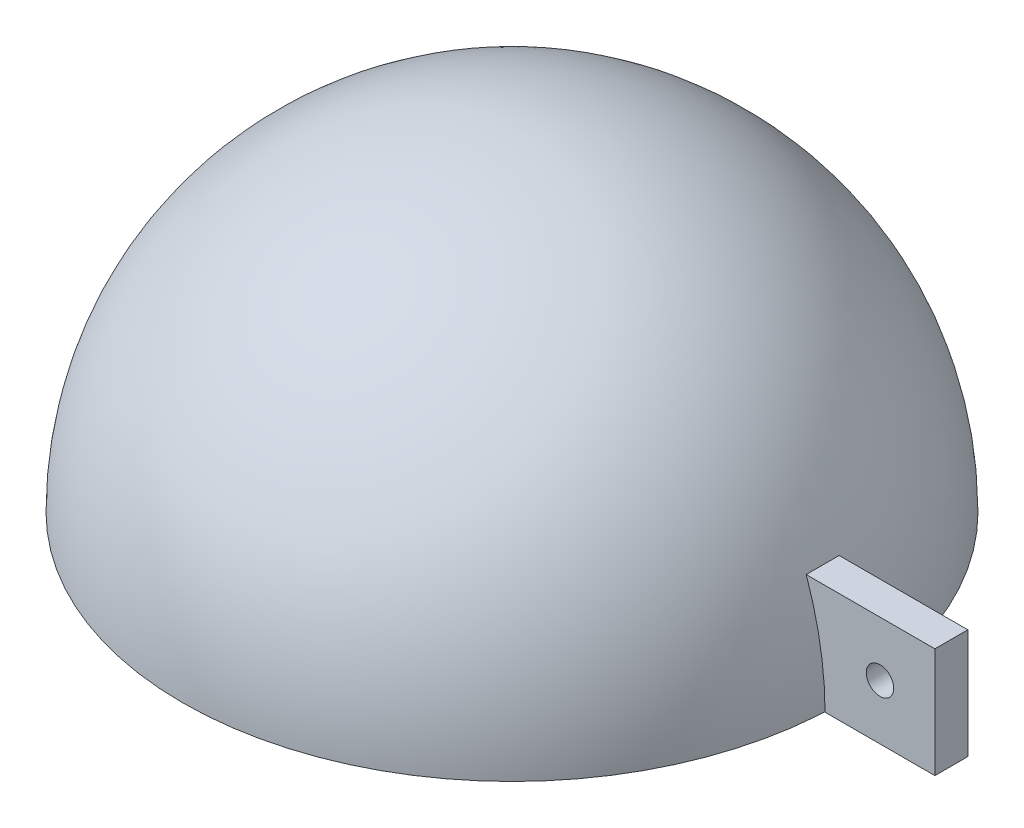
from build123d import *

# Parameters (mm, degrees)
SHELL2_T            = -3
BOSS_EXTRUDE1_DEPTH = 1.5
SKETCH5_W           = 1.25
SKETCH5_H           = 31.5


with BuildPart() as part:
    # Sketch2 → Revolve1 (revolve)
    with BuildSketch(Plane.XY):
        with BuildLine():
            Line((0, 0), (0, 30))
            ThreePointArc((0, 30), (21.213203436, 21.213203436), (30, 0))
            Line((30, 0), (0, 0))
        make_face()
    revolve(axis=Axis((0, 0, 0), (0, 1, 0)))

    # Shell2
    shell2_openings = [part.faces().sort_by_distance(p)[0] for p in [
        (0, 0, 0),
    ]]
    offset(amount=SHELL2_T, openings=shell2_openings, kind=Kind.INTERSECTION)


with BuildPart() as body_2:
    # Sketch4 → Boss-Extrude1 (new, symmetric)
    with BuildSketch(Plane.XY):
        with BuildLine():
            Line((30, 0), (40, 0))
            Line((40, 0), (40, 10))
            Line((40, 10), (28.284271247, 10))
            ThreePointArc((28.284271247, 10), (29.56795679, 5.073059362), (30, 0))
        make_face()
    extrude(amount=BOSS_EXTRUDE1_DEPTH, both=True)

    # Sketch5 → M3 Tapped Hole1 (revolve, cut)
    with BuildSketch(Plane(origin=(35, 5, 1.5), x_dir=(0, -1, 0), z_dir=(1, 0, 0))):
        with Locations((0.625, 15.75)):
            Rectangle(SKETCH5_W, SKETCH5_H)
    revolve(axis=Axis((35, 5, 7.85), (0, 0, -1)), mode=Mode.SUBTRACT)


solid = Compound([part.part, body_2.part])
